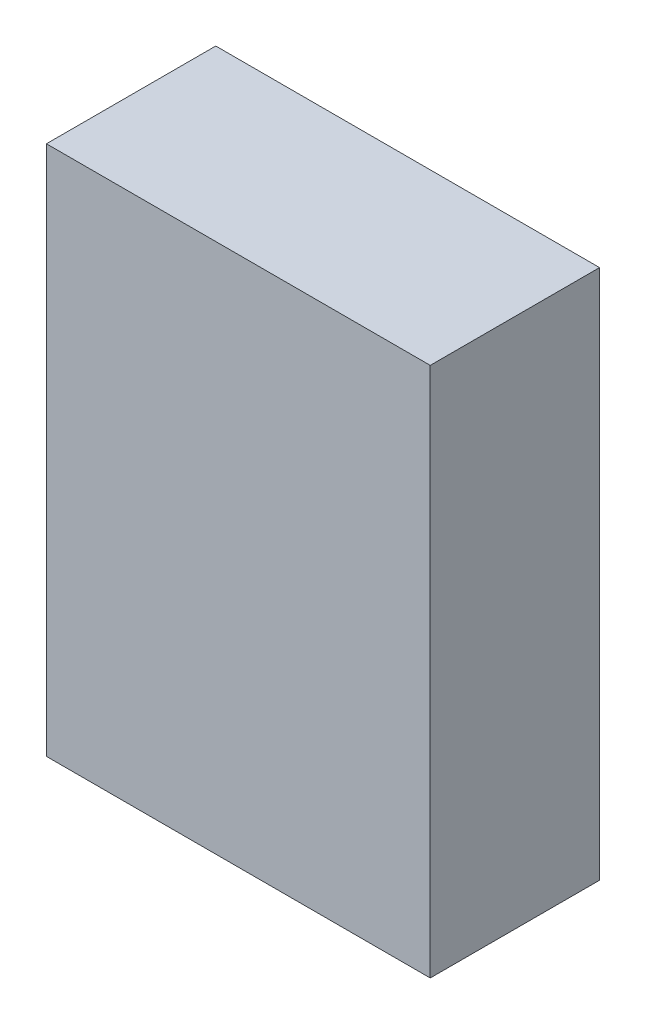
from build123d import *

# Parameters (mm, degrees)
SKETCH1_W           = 34
SKETCH1_H           = 15
BOSS_EXTRUDE1_DEPTH = 47


with BuildPart() as part:
    # Sketch1 → Boss-Extrude1 (new body)
    with BuildSketch(Plane(origin=(0, 0, 0), x_dir=(1, 0, 0), z_dir=(0, 1, 0))):
        with Locations((17, -7.5)):
            Rectangle(SKETCH1_W, SKETCH1_H)
    extrude(amount=BOSS_EXTRUDE1_DEPTH)


solid = part.part
